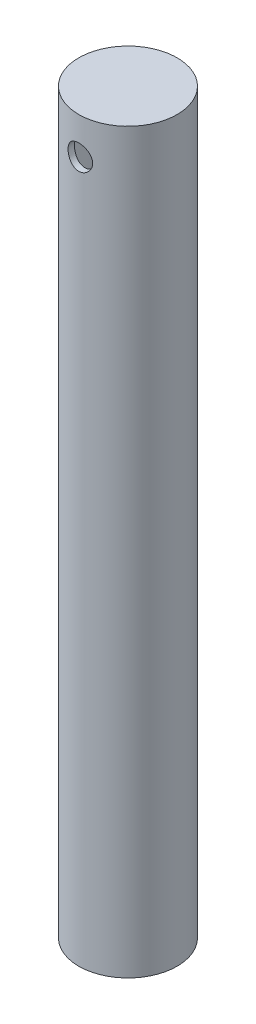
from build123d import *

# Parameters (mm, degrees)
SKETCH1_R               = 40
BOSS_EXTRUDE1_DEPTH     = 600
SHELL7_T                = 5
CUT_EXTRUDE2_DEPTH      = 40
CUT_EXTRUDE2_DEPTH_BACK = 40
SKETCH2_R               = 10


with BuildPart() as part:
    # Sketch1 → Boss-Extrude1 (new body)
    with BuildSketch(Plane(origin=(0, 0, 0), x_dir=(1, 0, 0), z_dir=(0, 1, 0))):
        Circle(SKETCH1_R)
    extrude(amount=BOSS_EXTRUDE1_DEPTH)

    # Shell7 (no face opened: a closed hollow body)
    add(offset(amount=-SHELL7_T, mode=Mode.PRIVATE), mode=Mode.SUBTRACT)

    # Sketch2 → Cut-Extrude2 (cut, two sides: drawn at the far end of the back side and taken through both)
    with BuildSketch(Plane.XY.offset(-CUT_EXTRUDE2_DEPTH_BACK)):
        with Locations((0, 570)):
            Circle(SKETCH2_R)
    extrude(amount=CUT_EXTRUDE2_DEPTH + CUT_EXTRUDE2_DEPTH_BACK, mode=Mode.SUBTRACT)


solid = part.part
